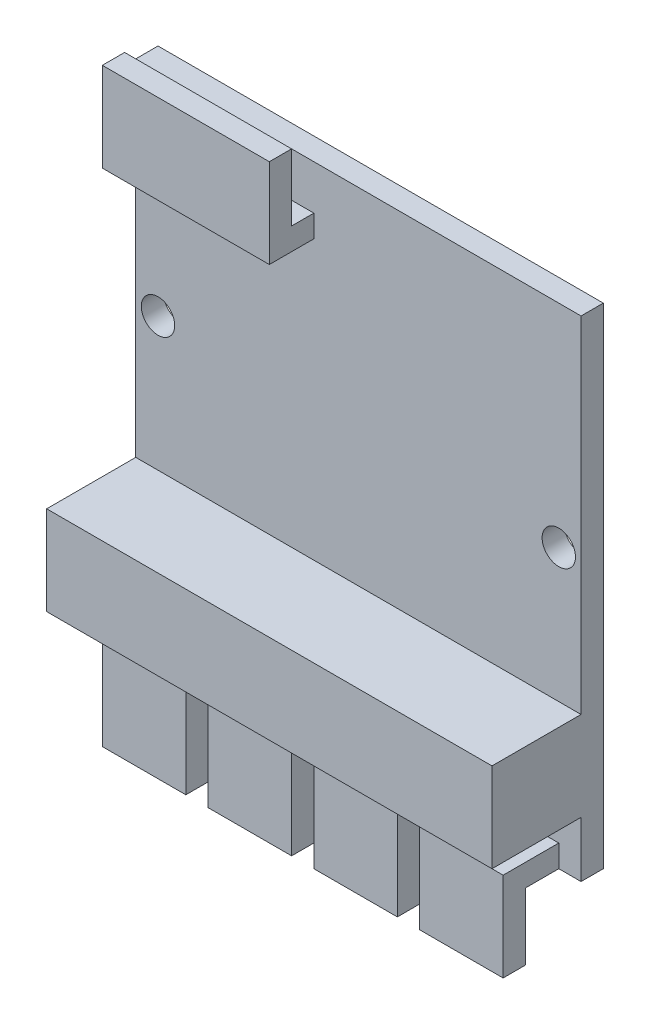
from build123d import *

# Parameters (mm, degrees)
ESQUISSE1_W             = 40
ESQUISSE1_H             = 44
BOSS_EXTRU_1_DEPTH      = 2
ESQUISSE2_W             = 40
ESQUISSE2_H             = 8
BOSS_EXTRU_2_DEPTH      = 8
ESQUISSE3_W             = 36
ESQUISSE3_H             = 2
BOSS_EXTRU_3_DEPTH      = 5
ESQUISSE4_W             = 36
ESQUISSE4_H             = 2
BOSS_EXTRU_4_DEPTH      = 6
ENL_V_MAT_EXTRU_1_REACH = 56.772
ESQUISSE5_W             = 2
ESQUISSE5_H             = 5
ESQUISSE6_W             = 15
ESQUISSE6_H             = 2
BOSS_EXTRU_5_DEPTH      = 4
ESQUISSE7_W             = 15
ESQUISSE7_H             = 2
BOSS_EXTRU_6_DEPTH      = 6
ENL_V_MAT_EXTRU_2_REACH = 37.327
ESQUISSE8_R             = 1.5


with BuildPart() as part:
    # Esquisse1 → Boss.-Extru.1 (new body)
    with BuildSketch(Plane.XY):
        Rectangle(ESQUISSE1_W, ESQUISSE1_H)
    extrude(amount=BOSS_EXTRU_1_DEPTH)

    # Esquisse2 → Boss.-Extru.2 (add)
    with BuildSketch(Plane.XY.offset(2)):
        with Locations((0, -13)):
            Rectangle(ESQUISSE2_W, ESQUISSE2_H)
    extrude(amount=BOSS_EXTRU_2_DEPTH)

    # Esquisse3 → Boss.-Extru.3 (add)
    with BuildSketch(Plane.XY.offset(2)):
        with Locations((0, -21)):
            Rectangle(ESQUISSE3_W, ESQUISSE3_H)
    extrude(amount=BOSS_EXTRU_3_DEPTH)

    # Esquisse4 → Boss.-Extru.4 (add)
    with BuildSketch(Plane.XZ.offset(22)):
        with Locations((0, 6)):
            Rectangle(ESQUISSE4_W, ESQUISSE4_H)
    extrude(amount=BOSS_EXTRU_4_DEPTH)

    # Esquisse5 → Enlèv. mat.-Extru.1 (cut, up to next)
    with BuildSketch(Plane.XZ.offset(28), mode=Mode.PRIVATE) as enl_v_mat_extru_1_sk1:
        with Locations((-9.5, 4.5)):
            Rectangle(ESQUISSE5_W, ESQUISSE5_H)
    enl_v_mat_extru_1_tool1 = extrude(enl_v_mat_extru_1_sk1.sketch, amount=-ENL_V_MAT_EXTRU_1_REACH, mode=Mode.PRIVATE) & part.part
    # Esquisse5 → Enlèv. mat.-Extru.1 (cut, up to next)
    with BuildSketch(Plane.XZ.offset(28), mode=Mode.PRIVATE) as enl_v_mat_extru_1_sk2:
        with Locations((0, 4.5)):
            Rectangle(ESQUISSE5_W, ESQUISSE5_H)
    enl_v_mat_extru_1_tool2 = extrude(enl_v_mat_extru_1_sk2.sketch, amount=-ENL_V_MAT_EXTRU_1_REACH, mode=Mode.PRIVATE) & part.part
    # Esquisse5 → Enlèv. mat.-Extru.1 (cut, up to next)
    with BuildSketch(Plane.XZ.offset(28), mode=Mode.PRIVATE) as enl_v_mat_extru_1_sk3:
        with Locations((9.5, 4.5)):
            Rectangle(ESQUISSE5_W, ESQUISSE5_H)
    enl_v_mat_extru_1_tool3 = extrude(enl_v_mat_extru_1_sk3.sketch, amount=-ENL_V_MAT_EXTRU_1_REACH, mode=Mode.PRIVATE) & part.part
    add(enl_v_mat_extru_1_tool1.solids().sort_by_distance((-9.5, -28, 4.5))[0], mode=Mode.SUBTRACT)
    add(enl_v_mat_extru_1_tool2.solids().sort_by_distance((0, -28, 4.5))[0], mode=Mode.SUBTRACT)
    add(enl_v_mat_extru_1_tool3.solids().sort_by_distance((9.5, -28, 4.5))[0], mode=Mode.SUBTRACT)

    # Esquisse6 → Boss.-Extru.5 (add)
    with BuildSketch(Plane.XY.offset(2)):
        with Locations((-11.5, 17)):
            Rectangle(ESQUISSE6_W, ESQUISSE6_H)
    extrude(amount=BOSS_EXTRU_5_DEPTH)

    # Esquisse7 → Boss.-Extru.6 (add)
    with BuildSketch(Plane(origin=(0, 18, 0), x_dir=(1, 0, 0), z_dir=(0, 1, 0))):
        with Locations((-11.5, -5)):
            Rectangle(ESQUISSE7_W, ESQUISSE7_H)
    extrude(amount=BOSS_EXTRU_6_DEPTH)

    # Esquisse8 → Enlèv. mat.-Extru.2 (cut, up to next)
    with BuildSketch(Plane.XY.offset(2), mode=Mode.PRIVATE) as enl_v_mat_extru_2_sk1:
        with Locations((18, 3)):
            Circle(ESQUISSE8_R)
    enl_v_mat_extru_2_tool1 = extrude(enl_v_mat_extru_2_sk1.sketch, amount=-ENL_V_MAT_EXTRU_2_REACH, mode=Mode.PRIVATE) & part.part
    enl_v_mat_extru_2 = enl_v_mat_extru_2_tool1.solids().sort_by_distance((18, 3, 2))[0]
    add(enl_v_mat_extru_2, mode=Mode.SUBTRACT)

    # Symétrie1: Enlèv. mat.-Extru.2 across plane
    add(enl_v_mat_extru_2.mirror(Plane(origin=(0, 0, 0), x_dir=(0, 0, 1), z_dir=(1, 0, 0))), mode=Mode.SUBTRACT)


solid = part.part
